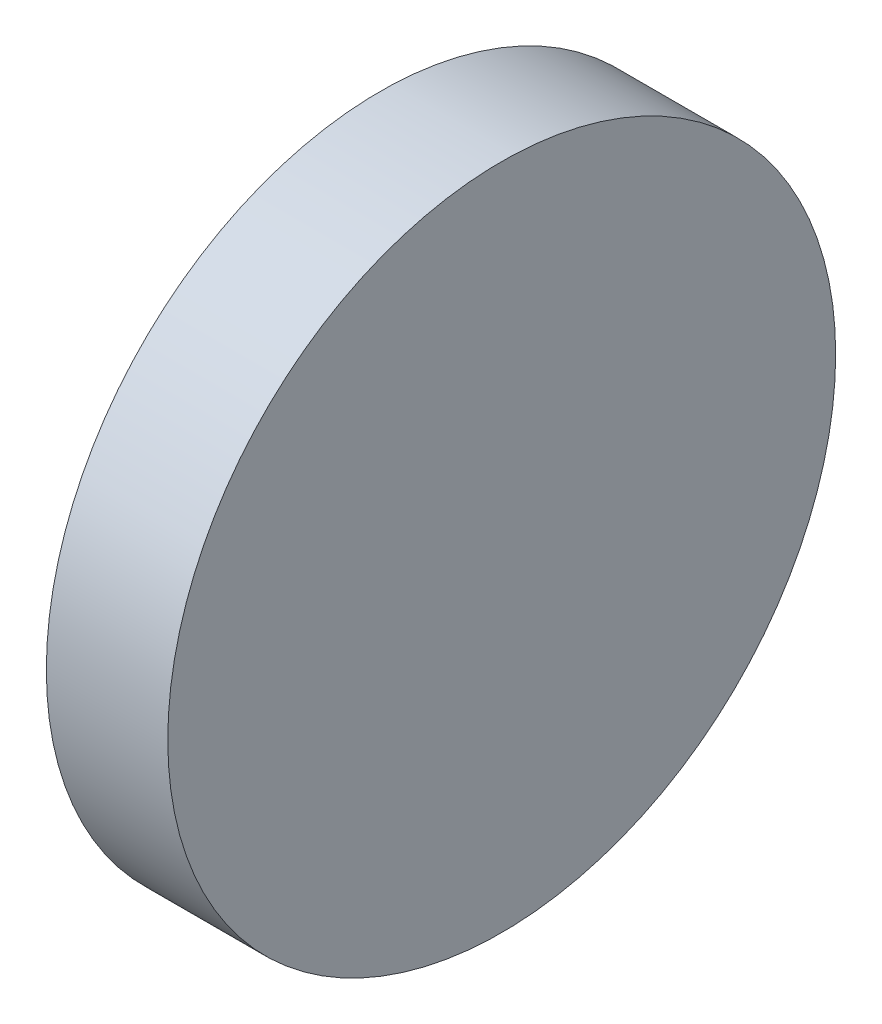
from build123d import *

# Parameters (mm, degrees)
AXIAL_PROFILE_MM_W = 4
AXIAL_PROFILE_MM_H = 11


with BuildPart() as part:
    # Axial profile (mm) → Full revolution (revolve)
    with BuildSketch(Plane.XY, mode=Mode.PRIVATE) as full_revolution_sk:
        with Locations((161.7, 5.5)):
            Rectangle(AXIAL_PROFILE_MM_W, AXIAL_PROFILE_MM_H)
    revolve(full_revolution_sk.sketch.rotate(Axis((-110, 0, 0), (1, 0, 0)), 90), axis=Axis((-110, 0, 0), (1, 0, 0)))


solid = part.part
